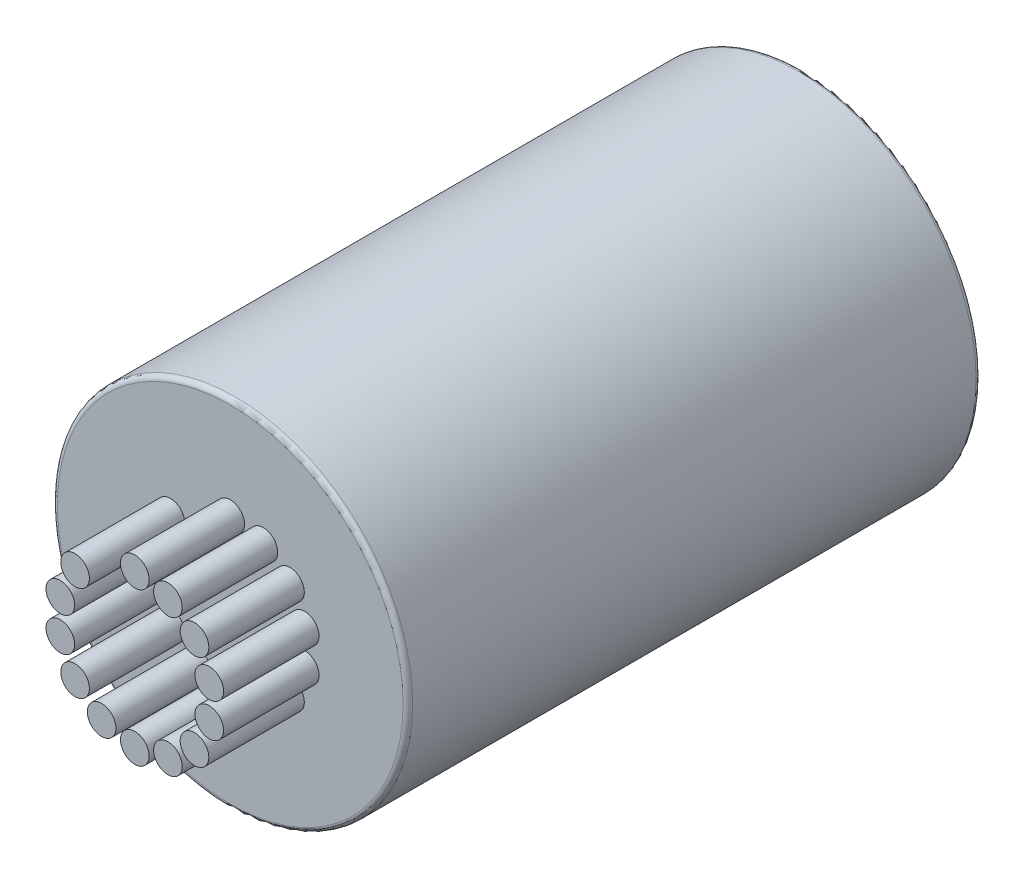
from build123d import *

# Parameters (mm, degrees)
SKETCH1_R           = 9.3
BOSS_EXTRUDE1_DEPTH = 30
SKETCH2_R           = 7.5
CUT_EXTRUDE1_DEPTH  = 0.1
SKETCH3_R           = 0.75
BOSS_EXTRUDE2_DEPTH = 5
FILLET1_R           = 0.25


with BuildPart() as part:
    # Sketch1 → Boss-Extrude1 (new body)
    with BuildSketch(Plane.XY):
        Circle(SKETCH1_R)
    extrude(amount=BOSS_EXTRUDE1_DEPTH)

    # Sketch2 → Cut-Extrude1 (cut)
    with BuildSketch(Plane(origin=(0, 0, 0), x_dir=(-1, 0, 0), z_dir=(0, 0, -1))):
        Circle(SKETCH2_R)
    extrude(amount=-CUT_EXTRUDE1_DEPTH, mode=Mode.SUBTRACT)

    # Sketch3 → Boss-Extrude2 (add)
    with BuildSketch(Plane.XY.offset(30)):
        with Locations((0, 4)):
            Circle(SKETCH3_R)
        with Locations((1.735534956, 3.603875472)):
            Circle(SKETCH3_R)
        with Locations((3.12732593, 2.493959207)):
            Circle(SKETCH3_R)
        with Locations((3.899711649, 0.890083736)):
            Circle(SKETCH3_R)
        with Locations((3.899711649, -0.890083736)):
            Circle(SKETCH3_R)
        with Locations((3.12732593, -2.493959207)):
            Circle(SKETCH3_R)
        with Locations((1.735534956, -3.603875472)):
            Circle(SKETCH3_R)
        with Locations((0, -4)):
            Circle(SKETCH3_R)
        with Locations((-1.735534956, -3.603875472)):
            Circle(SKETCH3_R)
        with Locations((-3.12732593, -2.493959207)):
            Circle(SKETCH3_R)
        with Locations((-3.899711649, -0.890083736)):
            Circle(SKETCH3_R)
        with Locations((-3.899711649, 0.890083736)):
            Circle(SKETCH3_R)
        with Locations((-3.12732593, 2.493959207)):
            Circle(SKETCH3_R)
    extrude(amount=BOSS_EXTRUDE2_DEPTH)

    # Fillet1
    fillet1_edges = [part.edges().sort_by_distance(p)[0] for p in [
        (-9.3, 0, 0),
        (-9.3, 0, 30),
    ]]
    fillet(fillet1_edges, radius=FILLET1_R)


solid = part.part
